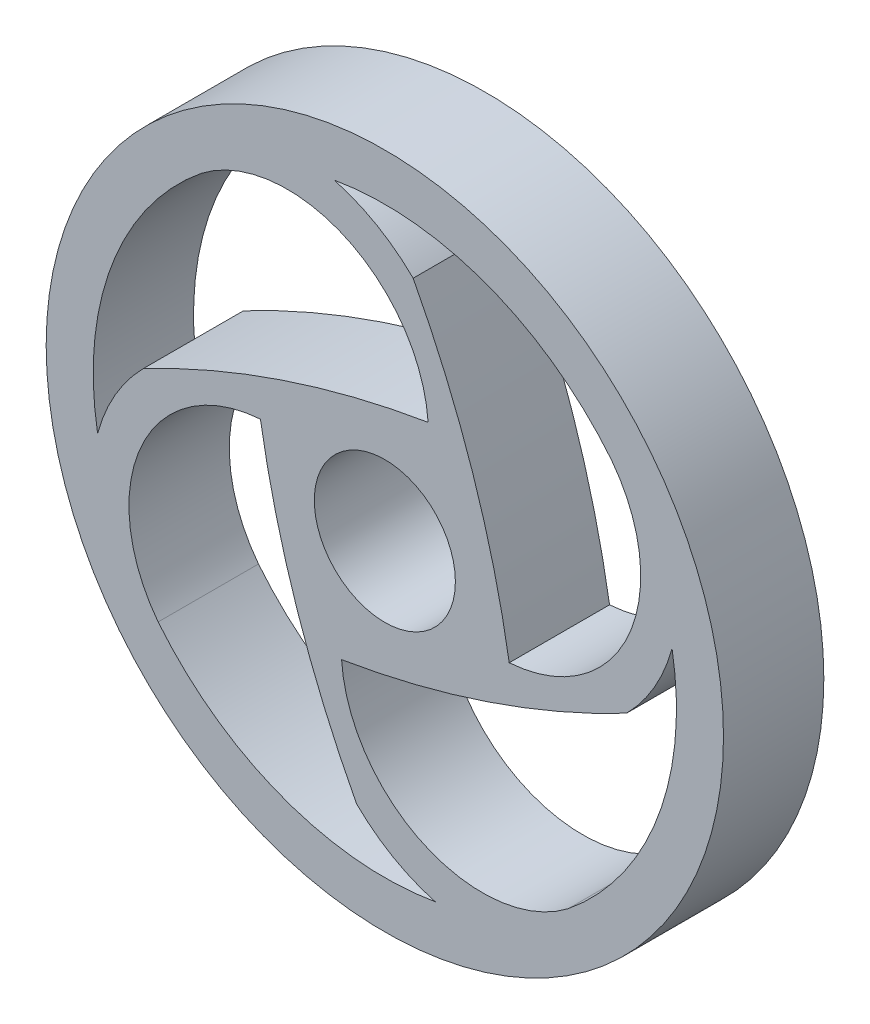
from build123d import *

# Parameters (mm, degrees)
SKETCH1_R           = 108
SKETCH1_R_2         = 22.5
BOSS_EXTRUDE2_DEPTH = 32


with BuildPart() as part:
    # Sketch1 → Boss-Extrude2 (new body)
    with BuildSketch(Plane.XY):
        Circle(SKETCH1_R)
        with BuildLine():
            ThreePointArc((-39.668209022, 13.799753366), (-28.005440993, -32.874640461), (-9.031806484, -77.084598511))
            ThreePointArc((-9.031806484, -77.084598511), (2.596198221, -85.966451462), (16.102221796, -91.595406289))
            ThreePointArc((16.102221796, -91.595406289), (-1.272703942, -92.991291123), (-18.602920008, -91.120422339))
            ThreePointArc((-18.602920008, -91.120422339), (-48.283083898, -79.484236232), (-72.289675848, -58.508142731))
            ThreePointArc((-72.289675848, -58.508142731), (-77.621570163, -12.590195167), (-39.668209022, 13.799753366))
        make_face(mode=Mode.SUBTRACT)
        with BuildLine():
            ThreePointArc((-13.799753366, -39.668209022), (32.874640461, -28.005440993), (77.084598511, -9.031806484))
            ThreePointArc((77.084598511, -9.031806484), (85.966451462, 2.596198221), (91.595406289, 16.102221796))
            ThreePointArc((91.595406289, 16.102221796), (92.991291123, -1.272703942), (91.120422339, -18.602920008))
            ThreePointArc((91.120422339, -18.602920008), (79.484236232, -48.283083898), (58.508142731, -72.289675848))
            ThreePointArc((58.508142731, -72.289675848), (12.590195167, -77.621570163), (-13.799753366, -39.668209022))
        make_face(mode=Mode.SUBTRACT)
        with BuildLine():
            ThreePointArc((13.799753366, 39.668209022), (-32.874640461, 28.005440993), (-77.084598511, 9.031806484))
            ThreePointArc((-77.084598511, 9.031806484), (-85.966451462, -2.596198221), (-91.595406289, -16.102221796))
            ThreePointArc((-91.595406289, -16.102221796), (-92.991291123, 1.272703942), (-91.120422339, 18.602920008))
            ThreePointArc((-91.120422339, 18.602920008), (-79.484236232, 48.283083898), (-58.508142731, 72.289675848))
            ThreePointArc((-58.508142731, 72.289675848), (-12.590195167, 77.621570163), (13.799753366, 39.668209022))
        make_face(mode=Mode.SUBTRACT)
        Circle(SKETCH1_R_2, mode=Mode.SUBTRACT)
        with BuildLine():
            ThreePointArc((39.668209022, -13.799753366), (28.005440993, 32.874640461), (9.031806484, 77.084598511))
            ThreePointArc((9.031806484, 77.084598511), (-2.596198221, 85.966451462), (-16.102221796, 91.595406289))
            ThreePointArc((-16.102221796, 91.595406289), (1.272703942, 92.991291123), (18.602920008, 91.120422339))
            ThreePointArc((18.602920008, 91.120422339), (48.283083898, 79.484236232), (72.289675848, 58.508142731))
            ThreePointArc((72.289675848, 58.508142731), (77.621570163, 12.590195167), (39.668209022, -13.799753366))
        make_face(mode=Mode.SUBTRACT)
    extrude(amount=BOSS_EXTRUDE2_DEPTH)


solid = part.part
